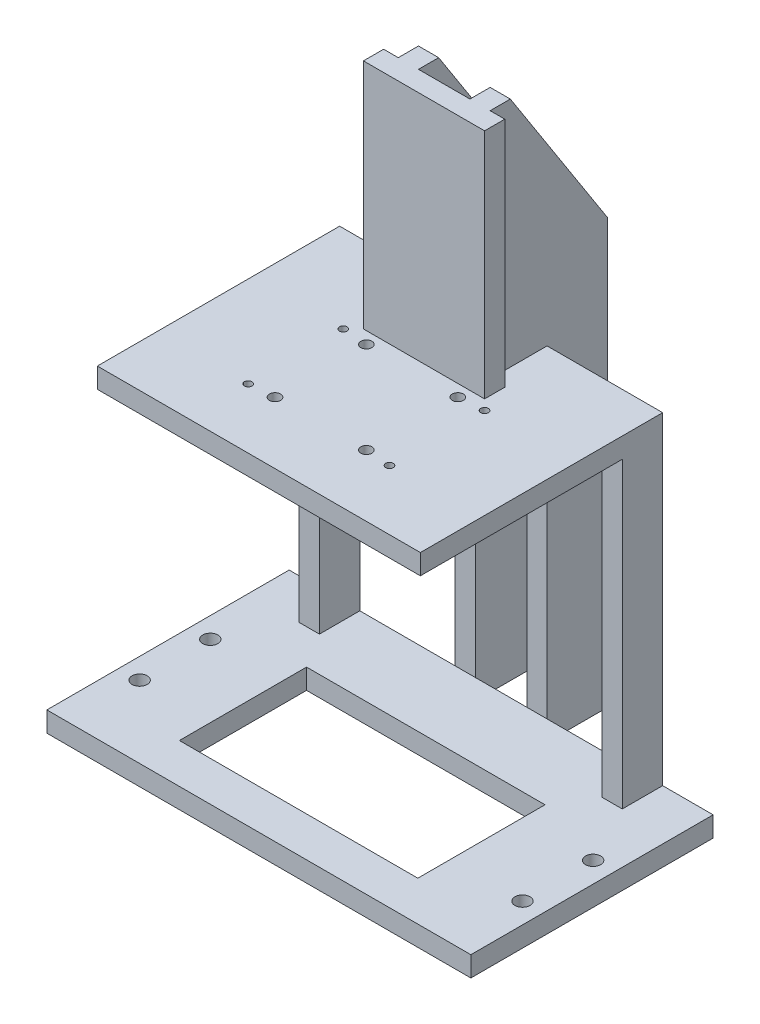
from build123d import *

# Parameters (mm, degrees)
SKETCH1_W           = 406.4
SKETCH1_H           = 431.8
SKETCH1_W_2         = 355.6
SKETCH1_H_2         = 381
BOSS_EXTRUDE1_DEPTH = 304.8
SKETCH2_W           = 254
SKETCH2_H           = 381
CUT_EXTRUDE1_DEPTH  = 552.975370827
BOSS_EXTRUDE2_DEPTH = 101.6
SKETCH4_W           = 25.4
SKETCH4_H           = 76.2
BOSS_EXTRUDE3_DEPTH = 533.4
BOSS_EXTRUDE4_DEPTH = 25.4
BOSS_EXTRUDE5_DEPTH = 25.4
SKETCH7_W           = 152.4
SKETCH7_H           = 25.4
BOSS_EXTRUDE6_DEPTH = 292.1
SKETCH8_R           = 4.7625
SKETCH8_R_2         = 7
CUT_EXTRUDE2_DEPTH  = 25.4
SKETCH9_R           = 12.7
CUT_EXTRUDE3_DEPTH  = 12.7
BOSS_EXTRUDE7_DEPTH = 25.4
SKETCH11_W          = 304.8
SKETCH11_H          = 25.4
BOSS_EXTRUDE8_DEPTH = 63.5
SKETCH12_W          = 304.8
SKETCH12_H          = 25.4
BOSS_EXTRUDE9_DEPTH = 63.5
SKETCH14_R          = 9.525
CUT_EXTRUDE4_DEPTH  = 830.495714275
SKETCH16_W          = 300
SKETCH16_H          = 160
CUT_EXTRUDE5_DEPTH  = 30


with BuildPart() as part:
    # Sketch1 → Boss-Extrude1 (new body)
    with BuildSketch(Plane.XY):
        Rectangle(SKETCH1_W, SKETCH1_H)
        Rectangle(SKETCH1_W_2, SKETCH1_H_2, mode=Mode.SUBTRACT)
    extrude(amount=BOSS_EXTRUDE1_DEPTH)

    # Sketch2 → Cut-Extrude1 (cut, through all)
    with BuildSketch(Plane(origin=(203.2, 0, 0), x_dir=(0, 0, -1), z_dir=(1, 0, 0))):
        with Locations((-177.8, 0)):
            Rectangle(SKETCH2_W, SKETCH2_H)
    extrude(amount=-CUT_EXTRUDE1_DEPTH, mode=Mode.SUBTRACT)

    # Sketch3 → Boss-Extrude2 (add)
    with BuildSketch(Plane(origin=(0, 215.9, 0), x_dir=(1, 0, 0), z_dir=(0, 1, 0))):
        Polygon((-57.785, 0), (-32.385, 0), (-32.385, -71.628), (32.385, -71.628), (32.385, 0), (57.785, 0), (57.785, -97.028), (32.385, -97.028), (-32.385, -97.028), (-57.785, -97.028), align=None)
    extrude(amount=BOSS_EXTRUDE2_DEPTH)

    # Sketch4 → Boss-Extrude3 (add)
    with BuildSketch(Plane.XZ.offset(215.9)):
        with Locations((-45.085, -38.1)):
            Rectangle(SKETCH4_W, SKETCH4_H)
        with Locations((45.085, -38.1)):
            Rectangle(SKETCH4_W, SKETCH4_H)
    extrude(amount=-BOSS_EXTRUDE3_DEPTH)

    # Sketch5 → Boss-Extrude4 (add)
    with BuildSketch(Plane.ZY.offset(57.785)):
        Polygon((-76.2, 317.5), (46.228, 508), (97.028, 508), (97.028, 317.5), align=None)
    extrude(amount=-BOSS_EXTRUDE4_DEPTH)

    # Sketch6 → Boss-Extrude5 (add)
    with BuildSketch(Plane(origin=(57.785, 0, 0), x_dir=(0, 0, -1), z_dir=(1, 0, 0))):
        Polygon((-46.228, 508), (-97.028, 508), (-97.028, 317.5), (76.2, 317.5), align=None)
    extrude(amount=-BOSS_EXTRUDE5_DEPTH)

    # Sketch7 → Boss-Extrude6 (add)
    with BuildSketch(Plane(origin=(0, 508, 0), x_dir=(1, 0, 0), z_dir=(0, 1, 0))):
        with Locations((0, -84.328)):
            Rectangle(SKETCH7_W, SKETCH7_H)
    extrude(amount=-BOSS_EXTRUDE6_DEPTH)

    # Sketch8 → Cut-Extrude2 (cut)
    with BuildSketch(Plane(origin=(0, 215.9, 0), x_dir=(1, 0, 0), z_dir=(0, 1, 0))):
        with Locations(Location((88.883, -229.362, 0), (0, 0, 270))):
            Circle(SKETCH8_R)
        with Locations(Location((57.5, -227.028, 0), (0, 0, 270))):
            Circle(SKETCH8_R_2)
        with Locations(Location((-88.917, -229.362, 0), (0, 0, 270))):
            Circle(SKETCH8_R)
        with Locations(Location((-57.5, -227.028, 0), (0, 0, 270))):
            Circle(SKETCH8_R_2)
        with Locations(Location((-88.917, -109.728, 0), (0, 0, 270))):
            Circle(SKETCH8_R)
        with Locations(Location((57.5, -112.028, 0), (0, 0, 270))):
            Circle(SKETCH8_R_2)
        with Locations(Location((88.883, -109.728, 0), (0, 0, 270))):
            Circle(SKETCH8_R)
        with Locations(Location((-57.5, -112.028, 0), (0, 0, 270))):
            Circle(SKETCH8_R_2)
    extrude(amount=-CUT_EXTRUDE2_DEPTH, mode=Mode.SUBTRACT)

    # Sketch9 → Cut-Extrude3 (cut)
    with BuildSketch(Plane.XZ.offset(-190.5)):
        with Locations(Location((-57.5, 227.028, 0), (0, 0, 270))):
            Circle(SKETCH9_R)
        with Locations(Location((57.5, 227.028, 0), (0, 0, 270))):
            Circle(SKETCH9_R)
        with Locations(Location((57.5, 112.028, 0), (0, 0, 270))):
            Circle(SKETCH9_R)
        with Locations(Location((-57.5, 112.028, 0), (0, 0, 270))):
            Circle(SKETCH9_R)
    extrude(amount=-CUT_EXTRUDE3_DEPTH, mode=Mode.SUBTRACT)

    # Sketch10 → Boss-Extrude7 (add)
    with BuildSketch(Plane(origin=(57.785, 0, 0), x_dir=(0, 0, -1), z_dir=(1, 0, 0))):
        Polygon((-71.628, 317.5), (76.2, 317.5), (-46.228, 508), (-71.628, 508), align=None)
    extrude(amount=-BOSS_EXTRUDE7_DEPTH)

    # Sketch11 → Boss-Extrude8 (add)
    with BuildSketch(Plane(origin=(203.2, 0, 0), x_dir=(0, 0, -1), z_dir=(1, 0, 0))):
        with Locations((-152.4, -203.2)):
            Rectangle(SKETCH11_W, SKETCH11_H)
    extrude(amount=BOSS_EXTRUDE8_DEPTH)

    # Sketch12 → Boss-Extrude9 (add)
    with BuildSketch(Plane.ZY.offset(203.2)):
        with Locations((152.4, -203.2)):
            Rectangle(SKETCH12_W, SKETCH12_H)
    extrude(amount=BOSS_EXTRUDE9_DEPTH)

    # Sketch14 → Cut-Extrude4 (cut, through all)
    with BuildSketch(Plane.XZ.offset(215.9)):
        with Locations(Location((-240.792, 213.978, 0), (0, 0, 270))):
            Circle(SKETCH14_R)
        with Locations(Location((-240.792, 125.078, 0), (0, 0, 90))):
            Circle(SKETCH14_R)
        with Locations(Location((240.792, 213.978, 0), (0, 0, 90))):
            Circle(SKETCH14_R)
        with Locations(Location((240.792, 125.078, 0), (0, 0, 270))):
            Circle(SKETCH14_R)
    extrude(amount=-CUT_EXTRUDE4_DEPTH, mode=Mode.SUBTRACT)

    # Sketch16 → Cut-Extrude5 (cut)
    with BuildSketch(Plane.XZ.offset(215.9)):
        with Locations((0, 174.8)):
            Rectangle(SKETCH16_W, SKETCH16_H)
    extrude(amount=-CUT_EXTRUDE5_DEPTH, mode=Mode.SUBTRACT)


solid = part.part
